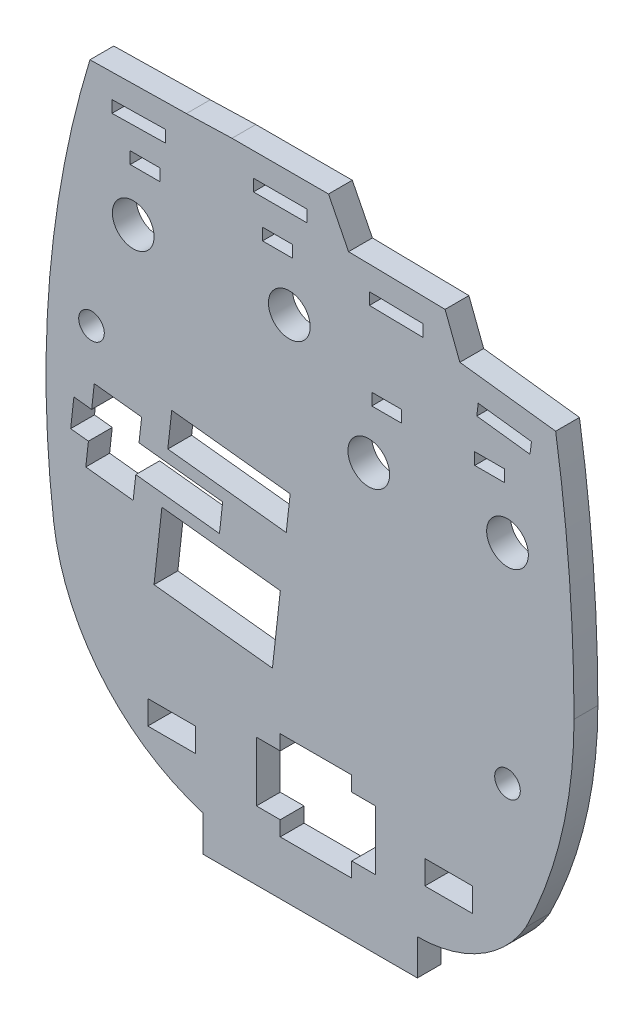
from build123d import *

# Parameters (mm, degrees)
SKETCH1_R           = 2.15
SKETCH1_R_2         = 3.5
SKETCH1_W           = 9.000072
SKETCH1_H           = 2
SKETCH1_W_2         = 5
BOSS_EXTRUDE1_DEPTH = 4
SKETCH2_W           = 8
SKETCH2_H           = 4
CUT_EXTRUDE1_DEPTH  = 97.206864696


with BuildPart() as part:
    # Sketch1 → Boss-Extrude1 (new body)
    with BuildSketch(Plane.XY):
        with BuildLine():
            Line((-12.978640908, -18), (-12.978640908, -24))
            Line((-12.978640908, -24), (23.021359092, -24))
            Line((23.021359092, -24), (23.021359092, -18))
            ThreePointArc((23.021359092, -18), (33.536808213, -15.187172163), (41.243562055, -7.5))
            ThreePointArc((41.243562055, -7.5), (47.269076761, 9.160930487), (49.313899811, 26.759570515))
            ThreePointArc((49.313899811, 26.759570515), (48.54170687, 46.985091914), (46.229623828, 67.092858318))
            Line((46.229623828, 67.092858318), (30.150376172, 69.067141682))
            Line((30.150376172, 69.067141682), (27.668766331, 75.523635508))
            Line((27.668766331, 75.523635508), (11.471233669, 75.806364492))
            Line((11.471233669, 75.806364492), (8.1, 82.51))
            Line((8.1, 82.51), (-8.1, 82.51))
            Line((-8.1, 82.51), (-15.746217975, 82.280462515))
            Line((-15.746217975, 82.280462515), (-31.943782025, 81.999537485))
            ThreePointArc((-31.943782025, 81.999537485), (-38.683922922, 47.231229605), (-38.032696315, 11.821617405))
            ThreePointArc((-38.032696315, 11.821617405), (-29.918009554, -6.796134249), (-12.978640908, -18))
        make_face()
        with Locations((38.147341743, 11.821617405)):
            Circle(SKETCH1_R, mode=Mode.SUBTRACT)
        with Locations((-24.678960076, 61.651218734)):
            Circle(SKETCH1_R_2, mode=Mode.SUBTRACT)
        with Locations((1.521420673, 61.651218734)):
            Circle(SKETCH1_R_2, mode=Mode.SUBTRACT)
        with Locations((14.86306514, 46.821617405)):
            Circle(SKETCH1_R_2, mode=Mode.SUBTRACT)
        with Locations((38.147341743, 46.821617405)):
            Circle(SKETCH1_R_2, mode=Mode.SUBTRACT)
        with Locations((-31.681501662, 43.456405989)):
            Circle(SKETCH1_R, mode=Mode.SUBTRACT)
        with Locations((0, 77.51)):
            Rectangle(SKETCH1_W, SKETCH1_H, mode=Mode.SUBTRACT)
        Polygon((-4, -2.5), (0, -2.5), (0, 0), (12, 0), (12, -2.5), (16, -2.5), (16, -12.5), (12, -12.5), (12, -15), (0, -15), (0, -12.5), (-4, -12.5), align=None, mode=Mode.SUBTRACT)
        with Locations((35.147341743, 56.321617405)):
            Rectangle(SKETCH1_W_2, SKETCH1_H, mode=Mode.SUBTRACT)
        Polygon((-28.274995137, 78.062566115), (-19.276276454, 78.218636824), (-19.241594351, 76.218937559), (-28.240313034, 76.062866849), align=None, mode=Mode.SUBTRACT)
        with Locations((17.86306514, 56.321617405)):
            Rectangle(SKETCH1_W_2, SKETCH1_H, mode=Mode.SUBTRACT)
        with Locations((-0.478579327, 71.151218734)):
            Rectangle(SKETCH1_W_2, SKETCH1_H, mode=Mode.SUBTRACT)
        Polygon((15.000839752, 71.744145677), (14.965934939, 69.744450286), (23.964636184, 69.587377372), (23.999540997, 71.587072762), align=None, mode=Mode.SUBTRACT)
        Polygon((42.16901604, 63.561398961), (33.236029212, 64.658231826), (32.992290526, 62.673139523), (41.925277354, 61.576306658), align=None, mode=Mode.SUBTRACT)
        Polygon((1.667459367, 35.705611754), (1.005748572, 29.742211816), (-18.872251222, 31.947914464), (-18.210540428, 37.911314402), align=None, mode=Mode.SUBTRACT)
        with Locations((-22.678960076, 71.151218734)):
            Rectangle(SKETCH1_W_2, SKETCH1_H, mode=Mode.SUBTRACT)
        Polygon((0.013182381, 20.797111909), (-1.310239208, 8.870312032), (-21.188239002, 11.076014679), (-19.864817414, 23.002814556), align=None, mode=Mode.SUBTRACT)
        Polygon((-10.203, 23.988271038), (-9.6615, 28.868319988), (-23.705306855, 30.426648908), (-23.264166325, 34.402248867), (-31.215366243, 35.284529926), (-31.656506773, 31.308929968), (-34.636711633, 31.639619464), (-35.178211633, 26.759570515), (-32.198006773, 26.428881018), (-32.639147302, 22.453281059), (-24.687947384, 21.571), (-24.246806855, 25.546599959), align=None, mode=Mode.SUBTRACT)
    extrude(amount=BOSS_EXTRUDE1_DEPTH)

    # Sketch2 → Cut-Extrude1 (cut, through all)
    with BuildSketch(Plane(origin=(0, 0, 0), x_dir=(-1, 0, 0), z_dir=(0, 0, -1))):
        with Locations((-28.271359092, -8)):
            Rectangle(SKETCH2_W, SKETCH2_H)
        with Locations((18.228640908, -8)):
            Rectangle(SKETCH2_W, SKETCH2_H)
    extrude(amount=-CUT_EXTRUDE1_DEPTH, mode=Mode.SUBTRACT)


solid = part.part
